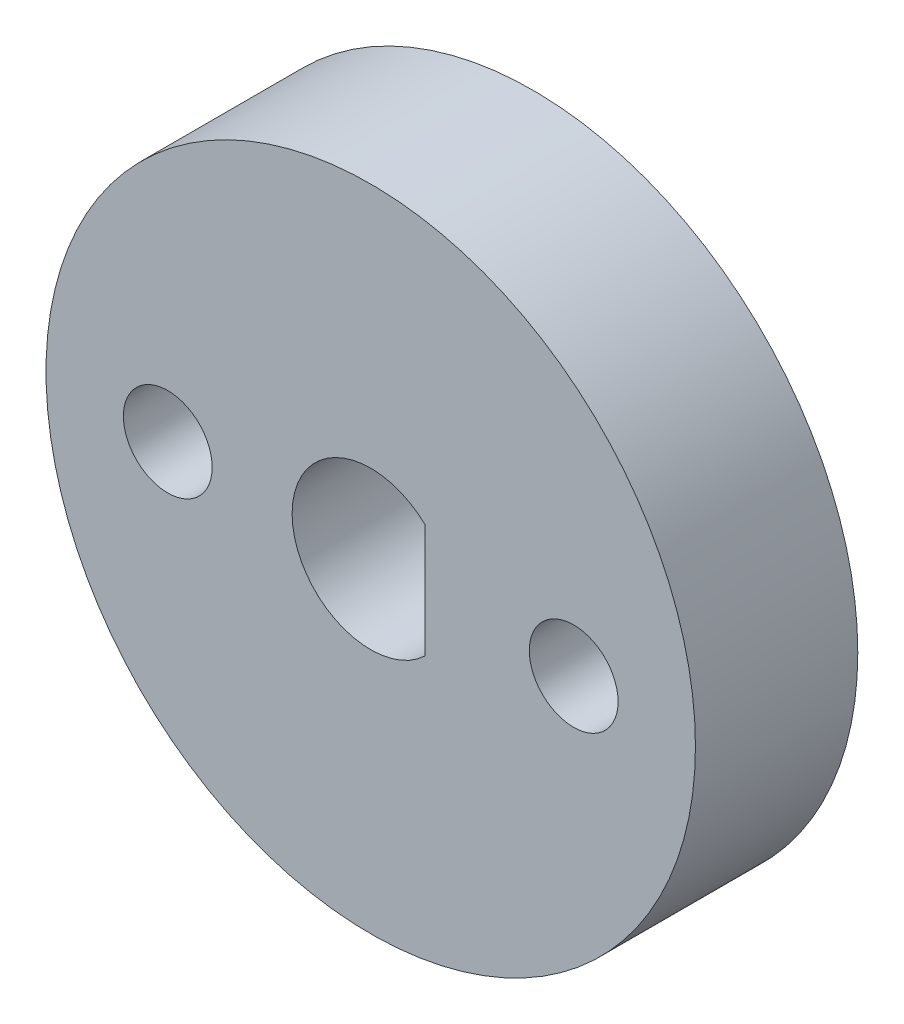
from build123d import *

# Parameters (mm, degrees)
SKETCH1_R               = 12.7
BOSS_EXTRUDE1_DEPTH     = 6.35
CUT_EXTRUDE1_DEPTH      = 20.05
CUT_EXTRUDE1_DEPTH_BACK = 20.05
SKETCH2_R               = 1.7359375


with BuildPart() as part:
    # Sketch1 → Boss-Extrude1 (new body)
    # profile 1 of 2: a face of its own
    with BuildSketch(Plane.XY):
        Circle(SKETCH1_R)
        with BuildLine():
            ThreePointArc((2.2225, 2.267403526), (-3.175, 0), (2.2225, -2.267403526))
            Line((2.2225, -2.267403526), (2.2225, 2.267403526))
        make_face(mode=Mode.SUBTRACT)
    # profile 2 of 2: a face of its own
    with BuildSketch(Plane.XY):
        with BuildLine():
            Line((2.2225, 2.267403526), (2.2225, -2.267403526))
            ThreePointArc((2.2225, -2.267403526), (-3.175, 0), (2.2225, 2.267403526))
        make_face()
        with BuildLine():
            ThreePointArc((2.1225, 2.224998596), (-3.075, 0), (2.1225, -2.224998596))
            Line((2.1225, -2.224998596), (2.1225, 2.224998596))
        make_face(mode=Mode.SUBTRACT)
    extrude(amount=BOSS_EXTRUDE1_DEPTH)

    # Sketch2 → Cut-Extrude1 (cut, two sides: drawn at the far end of the back side and taken through both)
    with BuildSketch(Plane.XY.offset(6.35).offset(-CUT_EXTRUDE1_DEPTH_BACK)):
        with Locations((7.9375, 0)):
            Circle(SKETCH2_R)
        with Locations((-7.9375, 0)):
            Circle(SKETCH2_R)
    extrude(amount=CUT_EXTRUDE1_DEPTH + CUT_EXTRUDE1_DEPTH_BACK, mode=Mode.SUBTRACT)


solid = part.part
